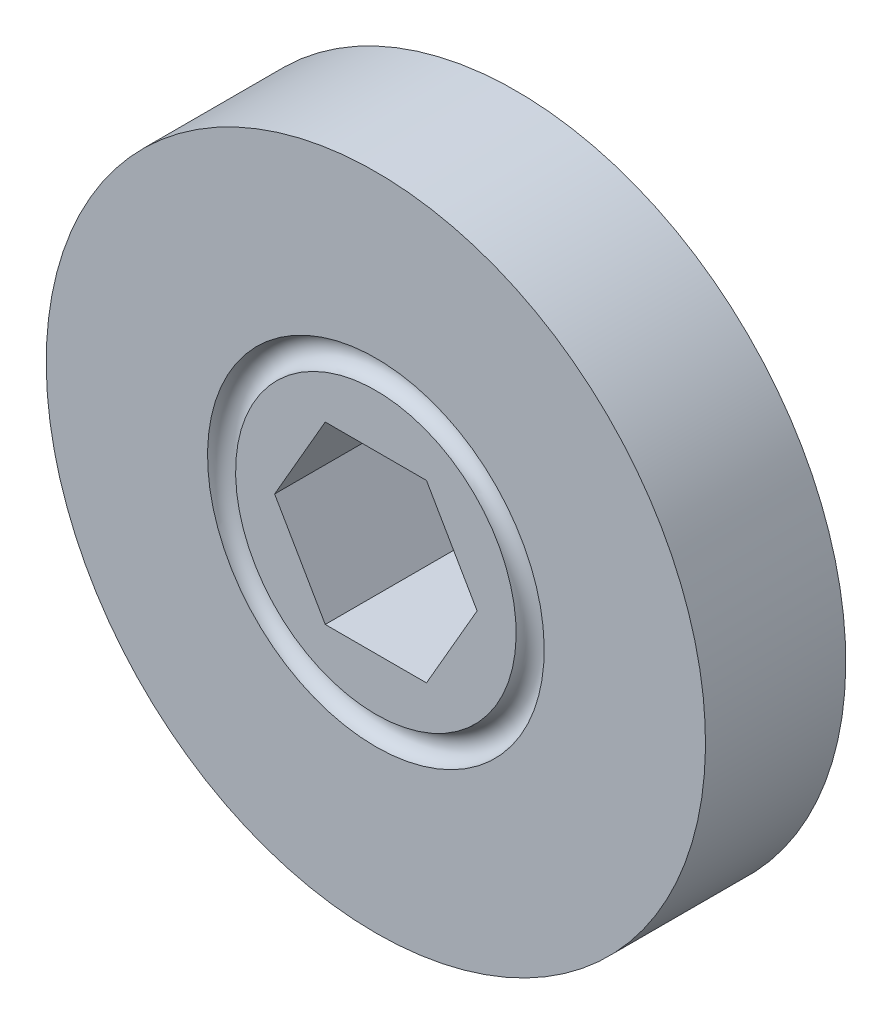
from build123d import *

# Parameters (mm, degrees)
CUT_EXTRUDE1_DEPTH = 10.16


with BuildPart() as part:
    # Sketch1 → Revolve1 (revolve)
    with BuildSketch(Plane(origin=(0, 0, 0), x_dir=(0, 0, -1), z_dir=(1, 0, 0))):
        with BuildLine():
            Line((-5.08, -11.938), (5.08, -11.938))
            Line((5.08, -11.938), (5.08, -0.254))
            ThreePointArc((5.08, -0.254), (4.064, 0.762), (5.08, 1.778))
            Line((5.08, 1.778), (5.08, 11.938))
            Line((5.08, 11.938), (-5.08, 11.938))
            Line((-5.08, 11.938), (-5.08, 1.778))
            ThreePointArc((-5.08, 1.778), (-4.064, 0.762), (-5.08, -0.254))
            Line((-5.08, -0.254), (-5.08, -11.938))
        make_face()
    revolve(axis=Axis((0, 11.938, 5.08), (0, 0, -1)))

    # Sketch2 → Cut-Extrude1 (cut)
    with BuildSketch(Plane.XY.offset(5.08)):
        Polygon((7.332348419, 11.938), (3.666174209, 18.288), (-3.666174209, 18.288), (-7.332348419, 11.938), (-3.666174209, 5.588), (3.666174209, 5.588), align=None)
    extrude(amount=-CUT_EXTRUDE1_DEPTH, mode=Mode.SUBTRACT)


solid = part.part
